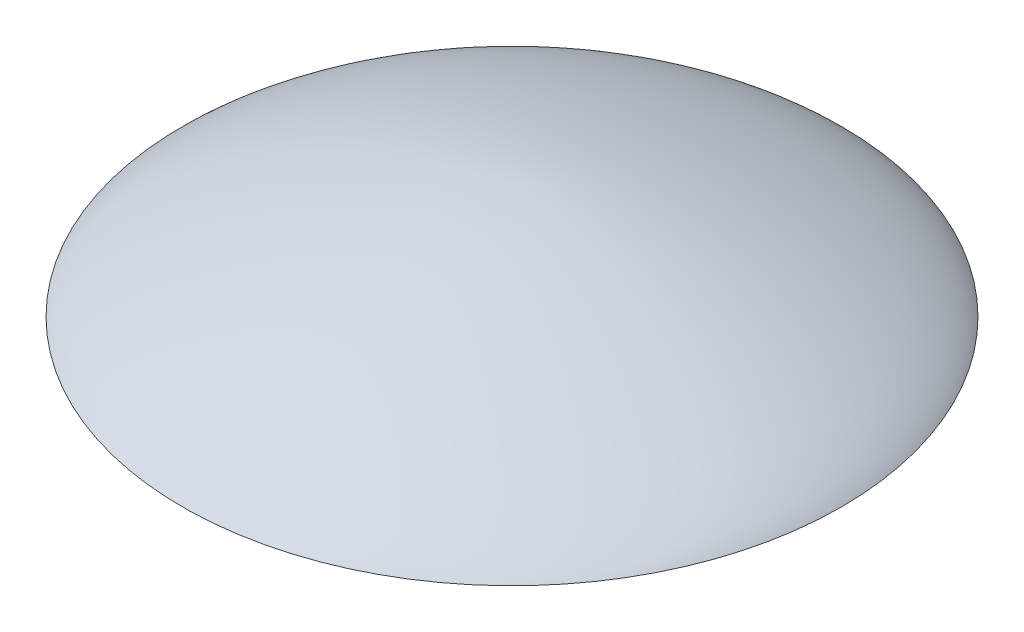
from build123d import *


with BuildPart() as part:
    # Sketch1 → Revolve1 (revolve)
    with BuildSketch(Plane.XY):
        with BuildLine():
            Line((0, 20.78967169), (0, 0))
            Line((0, 0), (67.5, 0))
            add(Edge.make_bspline(
                [(67.5, 0), (60.008828159, 7.591619238), (21.063054211, 21.75997284), (0, 20.78967169)],
                knots=[0, 0, 0, 0, 1, 1, 1, 1], degree=3))
        make_face()
    revolve(axis=Axis((0, -93.154205607, 0), (0, 1, 0)))


solid = part.part
